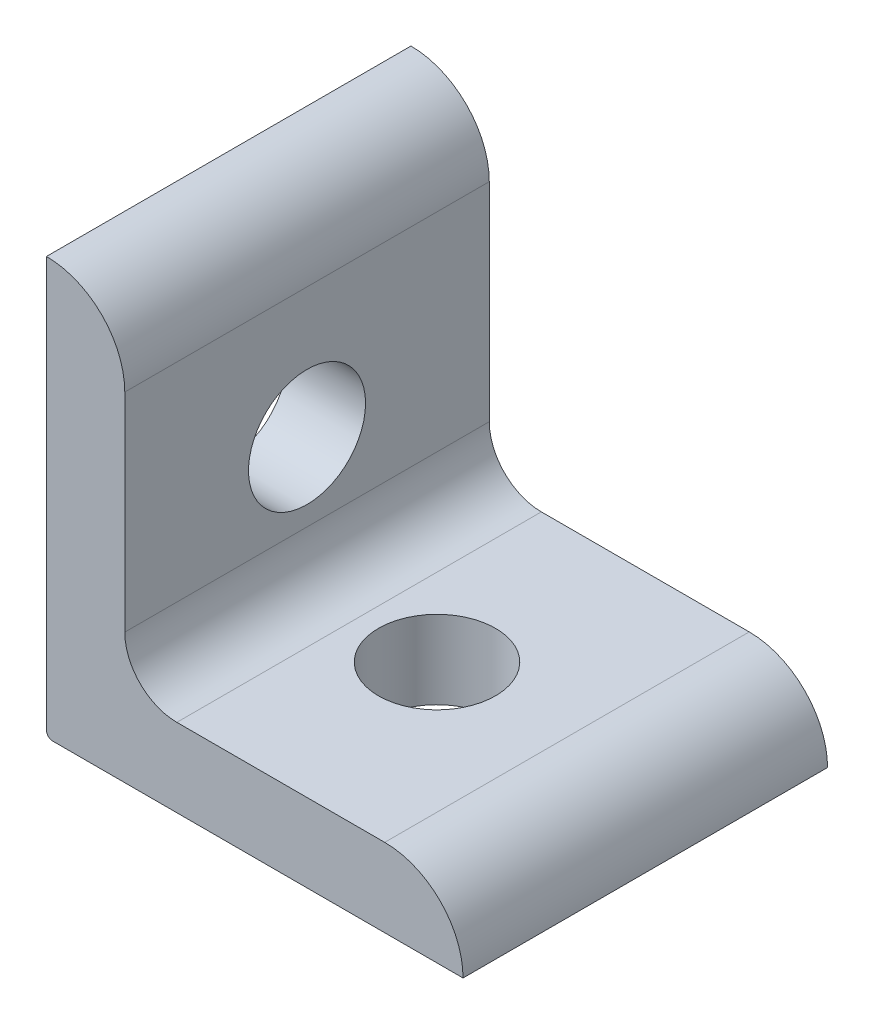
from build123d import *

# Parameters (mm, degrees)
BOSS_EXTRUDE1_DEPTH = 11.1125
HOLE1_D             = 7.1374
HOLE2_D             = 7.1374
FILLET1_R           = 0.381
FILLET2_R           = 3.175


with BuildPart() as part:
    # Sketch1 → Boss-Extrude1 (new, symmetric)
    with BuildSketch(Plane(origin=(0, 0, -11.1125), x_dir=(-1, 0, 0), z_dir=(0, 0, -1))):
        with BuildLine():
            Line((-25.4, 0), (0, 0))
            Line((0, 0), (0, 25.4))
            ThreePointArc((0, 25.4), (-3.376576302, 24.001376301), (-4.7752, 20.6248))
            Line((-4.7752, 20.6248), (-4.7752, 4.7752))
            Line((-4.7752, 4.7752), (-20.6248, 4.7752))
            ThreePointArc((-20.6248, 4.7752), (-24.001376302, 3.376576301), (-25.4, 0))
        make_face()
    extrude(amount=BOSS_EXTRUDE1_DEPTH, both=True)

    # Hole1 (through all)
    with Locations(Plane(origin=(0, 4.7752, 0), x_dir=(-1, 0, 0), z_dir=(0, 1, 0))):
        with Locations((-12.7, -11.1125)):
            Hole(HOLE1_D / 2)

    # Hole2 (through all)
    with Locations(Plane(origin=(4.7752, 0, 0), x_dir=(0, 0, -1), z_dir=(1, 0, 0))):
        with Locations((11.1125, 12.7)):
            Hole(HOLE2_D / 2)

    # Fillet1
    fillet1_edges = [part.edges().sort_by_distance(p)[0] for p in [
        (0, 0, -11.1125),
    ]]
    fillet(fillet1_edges, radius=FILLET1_R)

    # Fillet2
    fillet2_edges = [part.edges().sort_by_distance(p)[0] for p in [
        (4.7752, 4.7752, -11.1125),
    ]]
    fillet(fillet2_edges, radius=FILLET2_R)


solid = part.part
